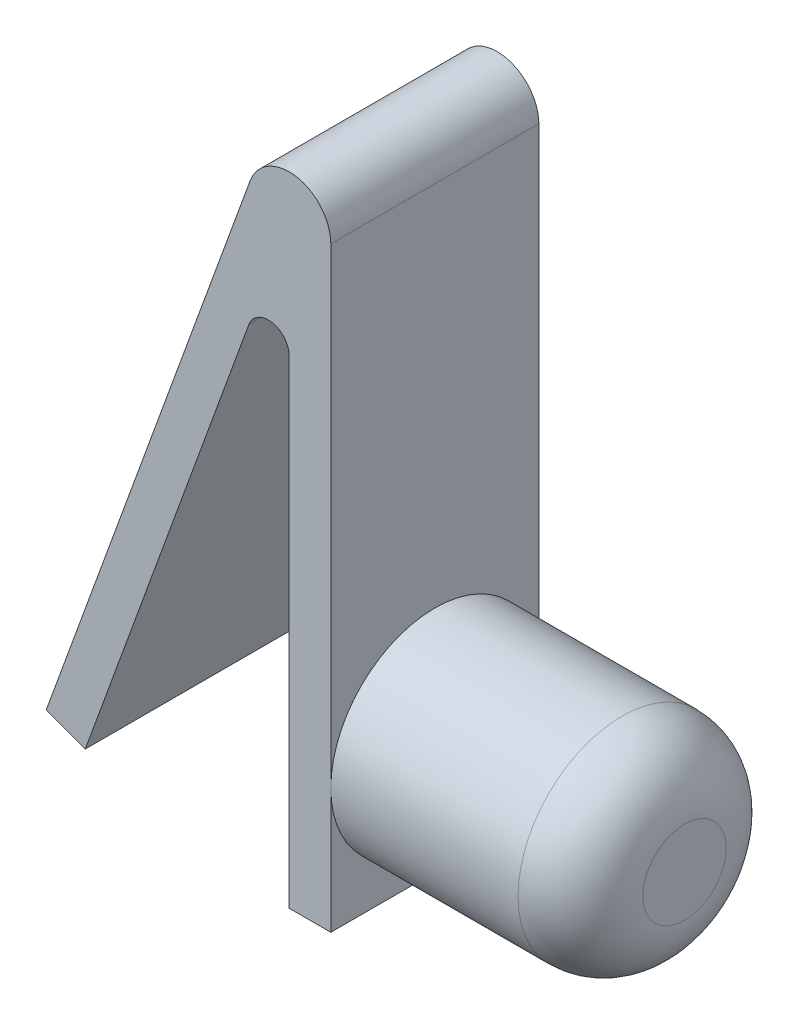
from build123d import *

# Parameters (mm, degrees)
BOSS_EXTRUDE1_DEPTH = 5
BOSS_EXTRUDE2_DEPTH = 6
FILLET1_R           = 1.5


with BuildPart() as part:
    # Sketch1 → Boss-Extrude1 (new body)
    with BuildSketch(Plane.XY):
        with BuildLine():
            Line((0, 0), (0, 11.493077271))
            ThreePointArc((0, 11.493077271), (-0.413175911, 11.985481147), (-0.96984631, 11.664087342))
            Line((-0.96984631, 11.664087342), (-4.900710246, 0.864127441))
            Line((-4.900710246, 0.864127441), (-5.840402867, 1.206147584))
            Line((-5.840402867, 1.206147584), (-0.939692621, 14.670738324))
            ThreePointArc((-0.939692621, 14.670738324), (0.173648178, 15.313525933), (1, 14.32871818))
            Line((1, 14.32871818), (1, 0))
            Line((1, 0), (0, 0))
        make_face()
    extrude(amount=BOSS_EXTRUDE1_DEPTH)

    # Sketch2 → Boss-Extrude2 (add)
    with BuildSketch(Plane(origin=(1, 0, 0), x_dir=(0, 0, -1), z_dir=(1, 0, 0))):
        with BuildLine():
            ThreePointArc((-2.5, 5.5), (-4.267766953, 1.232233047), (0, 3))
            ThreePointArc((0, 3), (-0.732233047, 4.767766953), (-2.5, 5.5))
        make_face()
    extrude(amount=BOSS_EXTRUDE2_DEPTH)

    # Fillet1
    fillet1_edges = [part.edges().sort_by_distance(p)[0] for p in [
        (7, 3, 5),
    ]]
    fillet(fillet1_edges, radius=FILLET1_R)


solid = part.part
